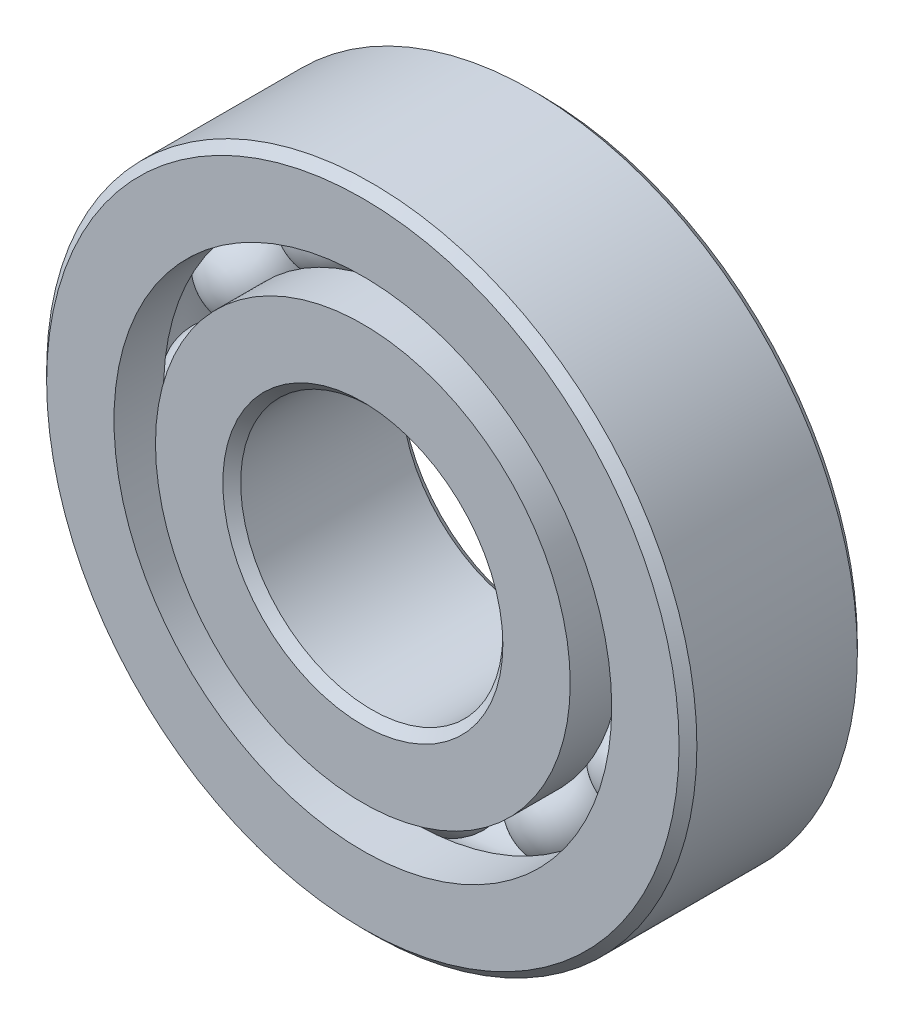
from build123d import *

# Parameters (mm, degrees)
CIRPATTERN1_COUNT = 12


with BuildPart() as part:
    # Sketch1 → Revolve1 (revolve)
    with BuildSketch(Plane(origin=(0, 0, 0), x_dir=(0, 0, -1), z_dir=(1, 0, 0))):
        with BuildLine():
            Line((7.65, 31), (-7.65, 31))
            Line((-7.65, 31), (-8.5, 30.15))
            Line((-8.5, 30.15), (-8.5, 23.728021978))
            Line((-8.5, 23.728021978), (-3.777777778, 23.728021978))
            ThreePointArc((-3.777777778, 23.728021978), (0, 26.014290783), (3.777777778, 23.728021978))
            Line((3.777777778, 23.728021978), (8.5, 23.728021978))
            Line((8.5, 23.728021978), (8.5, 30.15))
            Line((8.5, 30.15), (7.65, 31))
        make_face()
    revolve(axis=Axis((0, 0, 8.5), (0, 0, -1)))


with BuildPart() as body_2:
    # Sketch3 → Revolve3 (revolve)
    with BuildSketch(Plane(origin=(0, 0, 0), x_dir=(0, 0, -1), z_dir=(1, 0, 0))):
        with BuildLine():
            Line((-8.5, 19.771978022), (-3.777777778, 19.771978022))
            ThreePointArc((-3.777777778, 19.771978022), (0, 17.485709217), (3.777777778, 19.771978022))
            Line((3.777777778, 19.771978022), (8.5, 19.771978022))
            Line((8.5, 19.771978022), (8.5, 13.35))
            Line((8.5, 13.35), (7.65, 12.5))
            Line((7.65, 12.5), (-7.65, 12.5))
            Line((-7.65, 12.5), (-8.5, 13.35))
            Line((-8.5, 13.35), (-8.5, 19.771978022))
        make_face()
    revolve(axis=Axis((0, 0, 8.5), (0, 0, -1)))


with BuildPart() as body_3:
    # Sketch4 → Revolve4 (revolve)
    with BuildSketch(Plane(origin=(0, 0, 0), x_dir=(0, 0, -1), z_dir=(1, 0, 0))):
        with BuildLine():
            Line((-4.264290783, 21.75), (4.264290783, 21.75))
            ThreePointArc((4.264290783, 21.75), (0, 26.014290783), (-4.264290783, 21.75))
        make_face()
    revolve(axis=Axis((0, 21.75, 4.264290783), (0, 0, -1)))


with BuildPart() as cirpattern1_1:
    # CirPattern1: pattern copy
    add(body_3.part.rotate(Axis((0, 0, -8.5), (0, 0, 1)), 1 * 360 / CIRPATTERN1_COUNT))


with BuildPart() as cirpattern1_2:
    # CirPattern1: pattern copy
    add(body_3.part.rotate(Axis((0, 0, -8.5), (0, 0, 1)), 2 * 360 / CIRPATTERN1_COUNT))


with BuildPart() as cirpattern1_3:
    # CirPattern1: pattern copy
    add(body_3.part.rotate(Axis((0, 0, -8.5), (0, 0, 1)), 3 * 360 / CIRPATTERN1_COUNT))


with BuildPart() as cirpattern1_4:
    # CirPattern1: pattern copy
    add(body_3.part.rotate(Axis((0, 0, -8.5), (0, 0, 1)), 4 * 360 / CIRPATTERN1_COUNT))


with BuildPart() as cirpattern1_5:
    # CirPattern1: pattern copy
    add(body_3.part.rotate(Axis((0, 0, -8.5), (0, 0, 1)), 5 * 360 / CIRPATTERN1_COUNT))


with BuildPart() as cirpattern1_6:
    # CirPattern1: pattern copy
    add(body_3.part.rotate(Axis((0, 0, -8.5), (0, 0, 1)), 6 * 360 / CIRPATTERN1_COUNT))


with BuildPart() as cirpattern1_7:
    # CirPattern1: pattern copy
    add(body_3.part.rotate(Axis((0, 0, -8.5), (0, 0, 1)), 7 * 360 / CIRPATTERN1_COUNT))


with BuildPart() as cirpattern1_8:
    # CirPattern1: pattern copy
    add(body_3.part.rotate(Axis((0, 0, -8.5), (0, 0, 1)), 8 * 360 / CIRPATTERN1_COUNT))


with BuildPart() as cirpattern1_9:
    # CirPattern1: pattern copy
    add(body_3.part.rotate(Axis((0, 0, -8.5), (0, 0, 1)), 9 * 360 / CIRPATTERN1_COUNT))


with BuildPart() as cirpattern1_10:
    # CirPattern1: pattern copy
    add(body_3.part.rotate(Axis((0, 0, -8.5), (0, 0, 1)), 10 * 360 / CIRPATTERN1_COUNT))


with BuildPart() as cirpattern1_11:
    # CirPattern1: pattern copy
    add(body_3.part.rotate(Axis((0, 0, -8.5), (0, 0, 1)), 11 * 360 / CIRPATTERN1_COUNT))


solid = Compound([part.part, body_2.part, body_3.part, cirpattern1_1.part, cirpattern1_2.part, cirpattern1_3.part, cirpattern1_4.part, cirpattern1_5.part, cirpattern1_6.part, cirpattern1_7.part, cirpattern1_8.part, cirpattern1_9.part, cirpattern1_10.part, cirpattern1_11.part])
